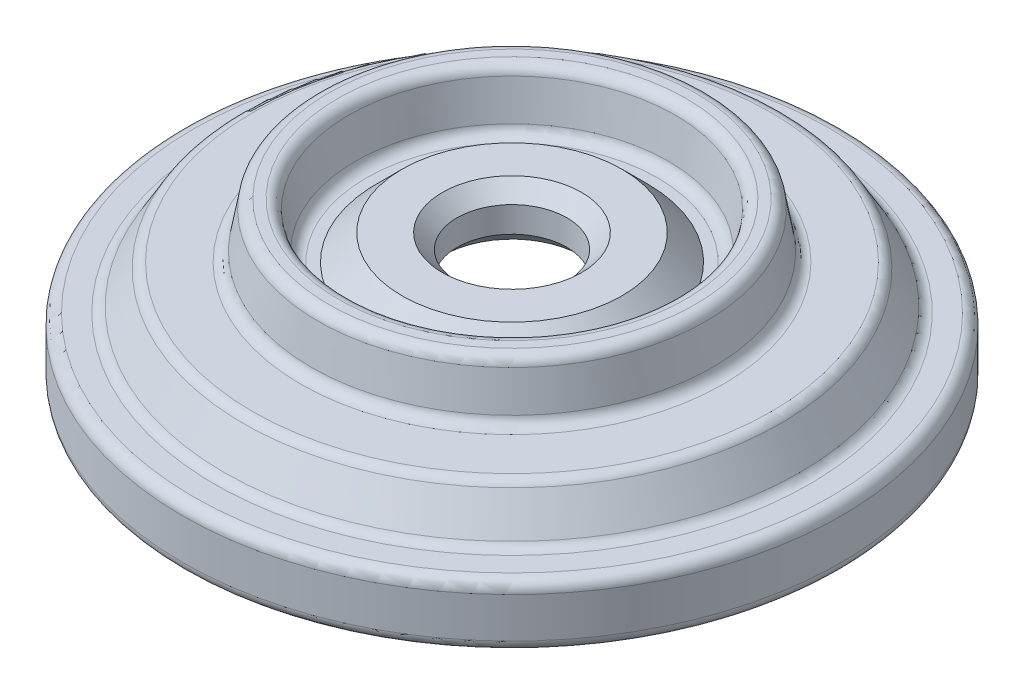
from build123d import *


with BuildPart() as part:
    # 草图1 → 旋转1 (revolve)
    with BuildSketch(Plane.XY, mode=Mode.PRIVATE) as revolve_1_sk:
        with BuildLine():
            ThreePointArc((90, 3), (89.121320344, 0.878679656), (87, 0))
            Line((87, 0), (80, 0))
            Line((80, 0), (68.741669751, 19.5))
            ThreePointArc((68.741669751, 19.5), (67.643593539, 20.598076211), (66.143593539, 21))
            Line((66.143593539, 21), (19, 21))
            Line((19, 21), (15, 25))
            Line((15, 25), (15, 32))
            Line((15, 32), (19, 36))
            Line((19, 36), (30, 36))
            Line((30, 36), (37, 29))
            Line((37, 29), (39.816232721, 29))
            ThreePointArc((39.816232721, 29), (41.74459555, 29.701866671), (42.77065598, 31.479055467))
            Line((42.77065598, 31.479055467), (44.541311959, 41.520944533))
            ThreePointArc((44.541311959, 41.520944533), (45.567372389, 43.298133329), (47.495735218, 44))
            Line((47.495735218, 44), (50.045576741, 44))
            ThreePointArc((50.045576741, 44), (51.97393957, 43.298133329), (53, 41.520944533))
            Line((53, 41.520944533), (54.77065598, 31.479055467))
            ThreePointArc((54.77065598, 31.479055467), (55.79671641, 29.701866671), (57.725079239, 29))
            Line((57.725079239, 29), (70.762395693, 29))
            ThreePointArc((70.762395693, 29), (72.262395693, 28.598076211), (73.360471904, 27.5))
            Line((73.360471904, 27.5), (78.556624327, 18.5))
            ThreePointArc((78.556624327, 18.5), (79.654700538, 17.401923789), (81.154700538, 17))
            Line((81.154700538, 17), (87, 17))
            ThreePointArc((87, 17), (89.121320344, 16.121320344), (90, 14))
            Line((90, 14), (90, 3))
        make_face()
    revolve(revolve_1_sk.sketch.rotate(Axis((0, 0, 0), (0, 1, 0)), 90), axis=Axis((0, 0, 0), (0, 1, 0)))


solid = part.part
